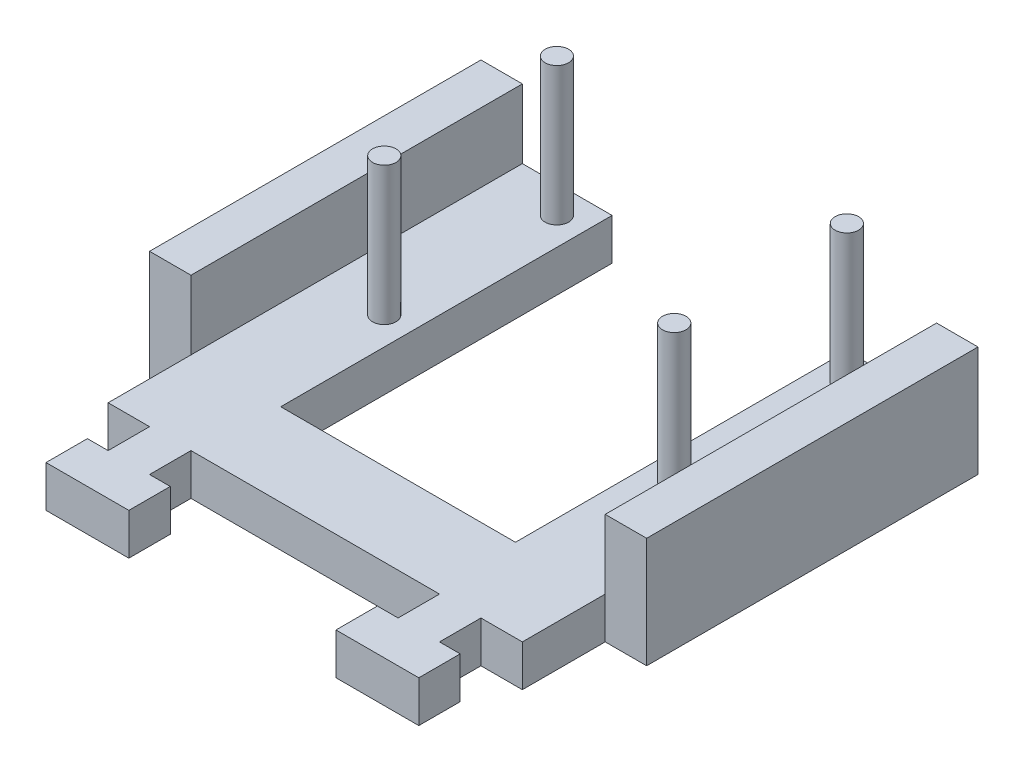
from build123d import *

# Parameters (mm, degrees)
BOSS_EXTRUDE1_DEPTH = 3
SKETCH2_R           = 0.85
SKETCH2_W           = 3
SKETCH2_H           = 24
BOSS_EXTRUDE2_DEPTH = 5
SKETCH3_R           = 0.85
BOSS_EXTRUDE3_DEPTH = 5


with BuildPart() as part:
    # Sketch1 → Boss-Extrude1 (new body)
    with BuildSketch(Plane(origin=(0, 0, 0), x_dir=(1, 0, 0), z_dir=(0, 1, 0))):
        Polygon((0, 0), (3, 0), (3, -3), (1.5, -3), (1.5, -6), (7.5, -6), (7.5, -3), (6, -3), (6, 0), (24, 0), (24, -3), (22.5, -3), (22.5, -6), (28.5, -6), (28.5, -3), (27, -3), (27, 0), (30, 0), (30, 6), (33, 6), (33, 30), (23.5, 30), (23.5, 6), (6.5, 6), (6.5, 30), (-3, 30), (-3, 6), (0, 6), align=None)
    extrude(amount=BOSS_EXTRUDE1_DEPTH)

    # Sketch2 → Boss-Extrude2 (add)
    with BuildSketch(Plane(origin=(0, 3, 0), x_dir=(1, 0, 0), z_dir=(0, 1, 0))):
        with Locations(Location((4.5, 28, 0), (0, 0, 270))):
            Circle(SKETCH2_R)
        with Locations(Location((25.5, 28, 0), (0, 0, 270))):
            Circle(SKETCH2_R)
        with Locations(Location((25.5, 15.5, 0), (0, 0, 270))):
            Circle(SKETCH2_R)
        with Locations(Location((4.5, 15.5, 0), (0, 0, 270))):
            Circle(SKETCH2_R)
        with Locations((-1.5, 18)):
            Rectangle(SKETCH2_W, SKETCH2_H)
        with Locations((31.5, 18)):
            Rectangle(SKETCH2_W, SKETCH2_H)
    extrude(amount=BOSS_EXTRUDE2_DEPTH)

    # Sketch3 → Boss-Extrude3 (add)
    with BuildSketch(Plane(origin=(0, 8, 0), x_dir=(1, 0, 0), z_dir=(0, 1, 0))):
        with Locations(Location((4.5, 28, 0), (0, 0, 270))):
            Circle(SKETCH3_R)
        with Locations(Location((25.5, 28, 0), (0, 0, 270))):
            Circle(SKETCH3_R)
        with Locations(Location((25.5, 15.5, 0), (0, 0, 270))):
            Circle(SKETCH3_R)
        with Locations(Location((4.5, 15.5, 0), (0, 0, 270))):
            Circle(SKETCH3_R)
    extrude(amount=BOSS_EXTRUDE3_DEPTH)


solid = part.part
